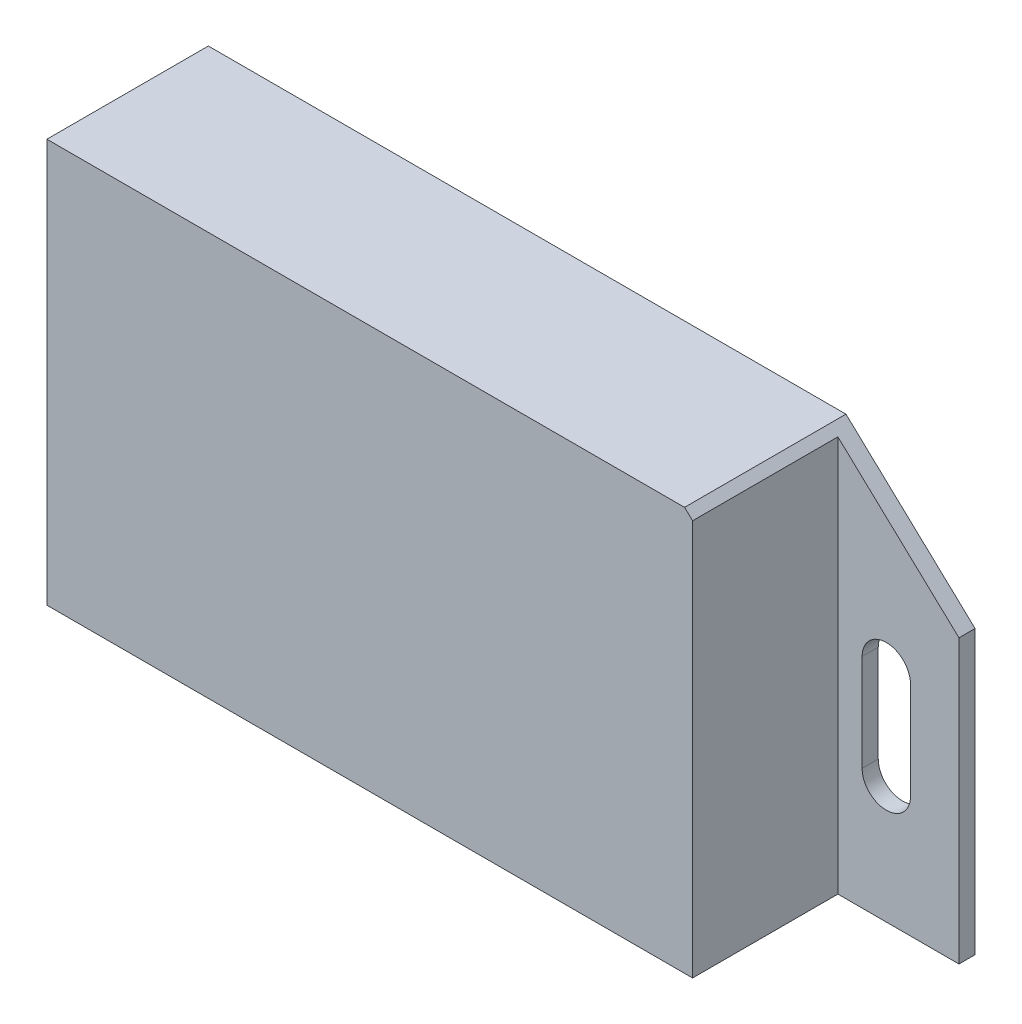
from build123d import *
from OCP.BRepFilletAPI import BRepFilletAPI_MakeChamfer

# Parameters (mm, degrees)
SKETCH_1_W          = 55
SKETCH_1_H          = 25
EXTRUDE_1_DEPTH     = 10
SKETCH_2_W          = 20.4
SKETCH_2_H          = 1.4
CUT_EXTRUDE_1_DEPTH = 2
SKETCH_3_W          = 7.5
SKETCH_3_H          = 9
CUT_EXTRUDE_2_DEPTH = 39.487010796
SKETCH_4_W          = 7.5
SKETCH_4_H          = 9
CUT_EXTRUDE_3_DEPTH = 39.487010796
CUT_EXTRUDE_4_DEPTH = 32.819805153
CUT_EXTRUDE_5_DEPTH = 32.819805153
SKETCH_7_W          = 20.995896459
SKETCH_7_H          = 1
EXTRUDE_2_DEPTH     = 0.8
SKETCH_8_W          = 20
SKETCH_8_H          = 1.5
CUT_EXTRUDE_6_DEPTH = 10
CHAMFER_1_SIZE      = 8
CHAMFER_1_SIZE2     = 7.5


with BuildPart() as part:
    # 草图1 → 凸台-拉伸1 (new body)
    with BuildSketch(Plane.XY):
        Rectangle(SKETCH_1_W, SKETCH_1_H)
    extrude(amount=-EXTRUDE_1_DEPTH)

    # 草图2 → 切除-拉伸1 (cut)
    with BuildSketch(Plane.XZ.offset(12.5)):
        with Locations((0, -2.5)):
            Rectangle(SKETCH_2_W, SKETCH_2_H)
    extrude(amount=-CUT_EXTRUDE_1_DEPTH, mode=Mode.SUBTRACT)

    # 草图3 → 切除-拉伸2 (cut, through all)
    with BuildSketch(Plane.XZ.offset(12.5)):
        with Locations((-23.75, -4.5)):
            Rectangle(SKETCH_3_W, SKETCH_3_H)
    extrude(amount=-CUT_EXTRUDE_2_DEPTH, mode=Mode.SUBTRACT)

    # 草图4 → 切除-拉伸3 (cut, through all)
    with BuildSketch(Plane.XZ.offset(12.5)):
        with Locations((23.75, -4.5)):
            Rectangle(SKETCH_4_W, SKETCH_4_H)
    extrude(amount=-CUT_EXTRUDE_3_DEPTH, mode=Mode.SUBTRACT)

    # 草图5 → 切除-拉伸4 (cut, through all)
    with BuildSketch(Plane(origin=(0, 0, -10), x_dir=(-1, 0, 0), z_dir=(0, 0, -1))):
        with BuildLine():
            Line((21.5, 1), (21.5, -5))
            ThreePointArc((21.5, -5), (23, -6.5), (24.5, -5))
            Line((24.5, -5), (24.5, 1))
            ThreePointArc((24.5, 1), (23, 2.5), (21.5, 1))
        make_face()
    extrude(amount=-CUT_EXTRUDE_4_DEPTH, mode=Mode.SUBTRACT)

    # 草图6 → 切除-拉伸5 (cut, through all)
    with BuildSketch(Plane(origin=(0, 0, -10), x_dir=(-1, 0, 0), z_dir=(0, 0, -1))):
        with BuildLine():
            Line((-24.5, 1), (-24.5, -5))
            ThreePointArc((-24.5, -5), (-23, -6.5), (-21.5, -5))
            Line((-21.5, -5), (-21.5, 1))
            ThreePointArc((-21.5, 1), (-23, 2.5), (-24.5, 1))
        make_face()
    extrude(amount=-CUT_EXTRUDE_5_DEPTH, mode=Mode.SUBTRACT)

    # 草图7 → 凸台-拉伸2 (add)
    with BuildSketch(Plane(origin=(0, 0, -2.8), x_dir=(-1, 0, 0), z_dir=(0, 0, -1))):
        with Locations((0.49794823, -13)):
            Rectangle(SKETCH_7_W, SKETCH_7_H)
    extrude(amount=-EXTRUDE_2_DEPTH)

    # 草图8 → 切除-拉伸6 (cut)
    with BuildSketch(Plane.XZ.offset(12.5)):
        with Locations((0, -8.25)):
            Rectangle(SKETCH_8_W, SKETCH_8_H)
    extrude(amount=-CUT_EXTRUDE_6_DEPTH, mode=Mode.SUBTRACT)

    # 倒角1: one chamfer whose edges measure the first distance from different faces: ONE call of the kernel's chamfer builder (chamfer() names one face for all edges)
    chamfer_1_edges_1 = [part.edges().sort_by_distance(p)[0] for p in [
        (27.5, 12.5, -9.5),
    ]]
    chamfer_1_side_1 = [part.faces().sort_by_distance(p)[0] for p in [
        (0, 12.5, -5.162650602),
    ]]
    chamfer_1_edges_2 = [part.edges().sort_by_distance(p)[0] for p in [
        (-27.5, 12.5, -9.5),
    ]]
    chamfer_1_side_2 = [part.faces().sort_by_distance(p)[0] for p in [
        (-27.5, 0, -9.5),
    ]]
    chamfer_1 = BRepFilletAPI_MakeChamfer(part.part.solid().wrapped)
    for e in chamfer_1_edges_1:
        chamfer_1.Add(CHAMFER_1_SIZE, CHAMFER_1_SIZE2, e.wrapped, chamfer_1_side_1[0].wrapped)  # the first distance lies on this face
    for e in chamfer_1_edges_2:
        chamfer_1.Add(CHAMFER_1_SIZE, CHAMFER_1_SIZE2, e.wrapped, chamfer_1_side_2[0].wrapped)  # the first distance lies on this face
    add(Compound.cast(chamfer_1.Shape()), mode=Mode.REPLACE)


solid = part.part
